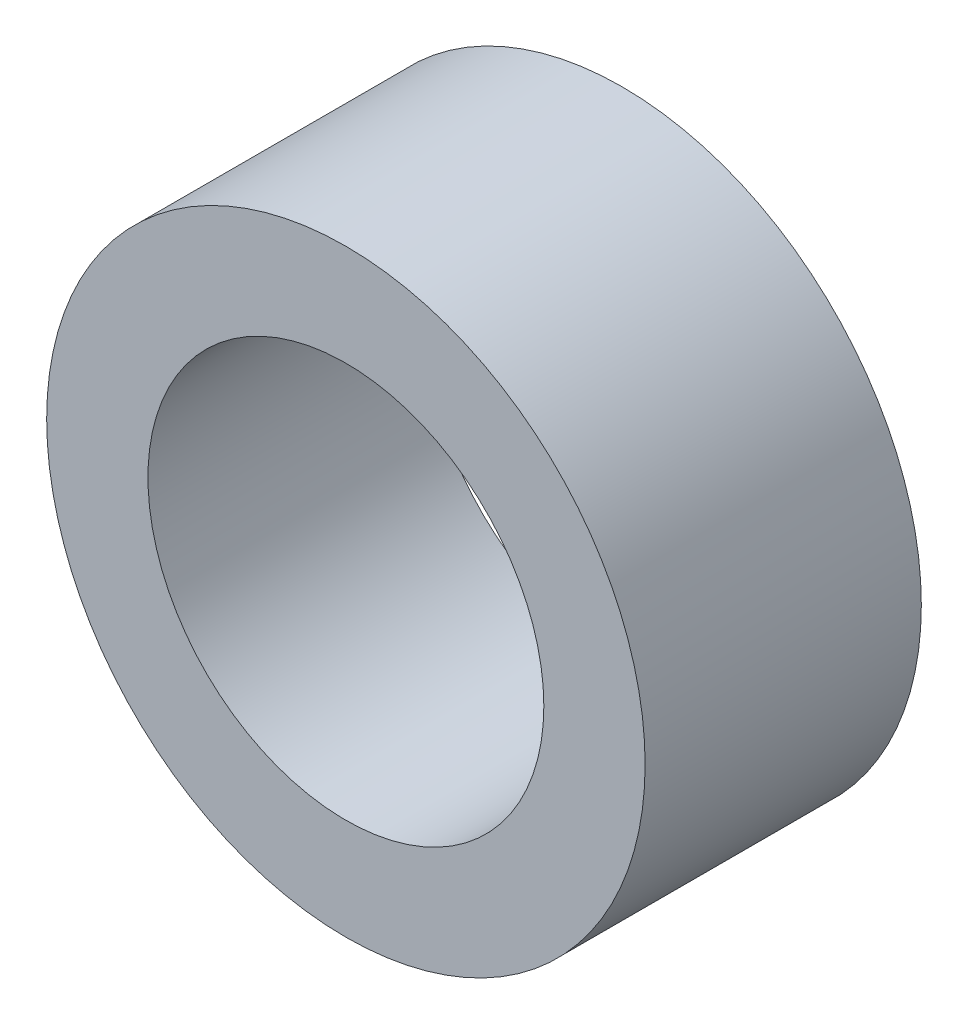
from build123d import *

# Parameters (mm, degrees)
SKETCH_1_R      = 3.25
SKETCH_1_R_2    = 2.15
EXTRUDE_1_DEPTH = 3


with BuildPart() as part:
    # 草图1 → 凸台-拉伸1 (new body)
    with BuildSketch(Plane.XY):
        Circle(SKETCH_1_R)
        Circle(SKETCH_1_R_2, mode=Mode.SUBTRACT)
    extrude(amount=EXTRUDE_1_DEPTH)


solid = part.part
